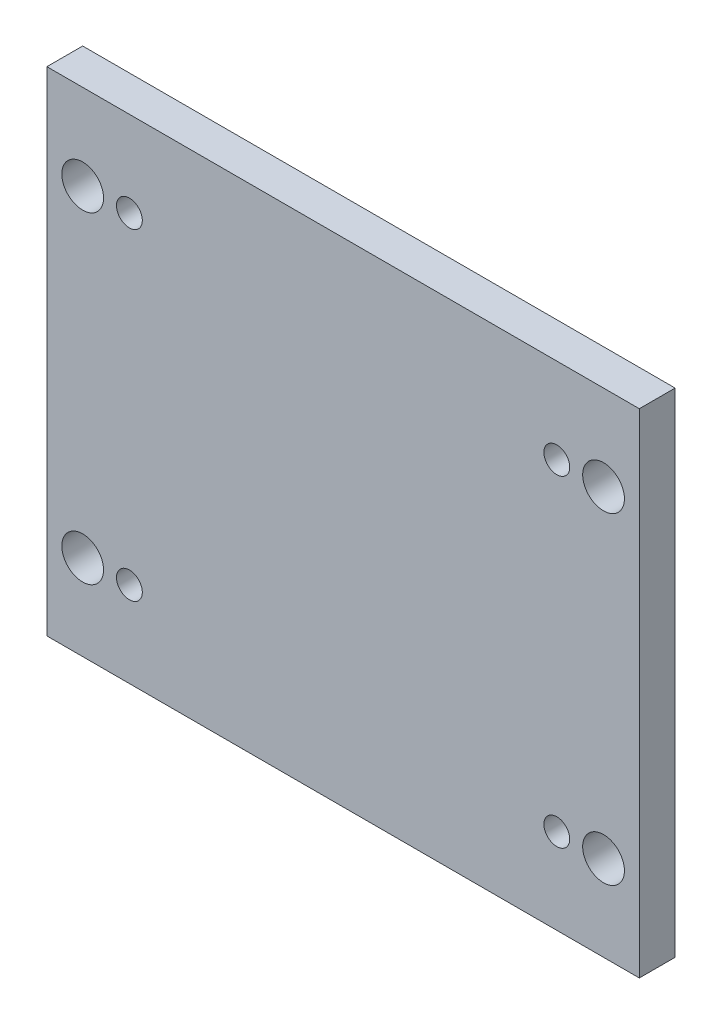
from build123d import *

# Parameters (mm, degrees)
SZKIC1_W                    = 596
SZKIC1_H                    = 496
DODANIE_WYCI_GNI_CIE1_DEPTH = 36
SZKIC2_R                    = 21
WYTNIJ_WYCI_GNI_CIE1_DEPTH  = 36
SZKIC3_R                    = 21
WYTNIJ_WYCI_GNI_CIE2_DEPTH  = 36
SZKIC4_R                    = 21
WYTNIJ_WYCI_GNI_CIE3_DEPTH  = 36
SZKIC5_R                    = 21
WYTNIJ_WYCI_GNI_CIE4_DEPTH  = 36
SZKIC6_W                    = 15
SZKIC6_H                    = 9
SZKIC7_W                    = 15
SZKIC7_H                    = 9
SZKIC8_W                    = 15
SZKIC8_H                    = 9
SZKIC9_W                    = 15
SZKIC9_H                    = 9
SZKIC10_W                   = 21
SZKIC10_H                   = 13
SZKIC11_W                   = 21
SZKIC11_H                   = 13
SZKIC12_W                   = 21
SZKIC12_H                   = 13
SZKIC13_W                   = 21
SZKIC13_H                   = 13


with BuildPart() as part:
    # Szkic1 → Dodanie-wyciągnięcie1 (new body)
    with BuildSketch(Plane.XY):
        Rectangle(SZKIC1_W, SZKIC1_H)
    extrude(amount=DODANIE_WYCI_GNI_CIE1_DEPTH)

    # Szkic2 → Wytnij-wyciągnięcie1 (cut)
    with BuildSketch(Plane.XY.offset(36)):
        with Locations((262, 162)):
            Circle(SZKIC2_R)
    extrude(amount=-WYTNIJ_WYCI_GNI_CIE1_DEPTH, mode=Mode.SUBTRACT)

    # Szkic3 → Wytnij-wyciągnięcie2 (cut)
    with BuildSketch(Plane.XY.offset(36)):
        with Locations((262, -162)):
            Circle(SZKIC3_R)
    extrude(amount=-WYTNIJ_WYCI_GNI_CIE2_DEPTH, mode=Mode.SUBTRACT)

    # Szkic4 → Wytnij-wyciągnięcie3 (cut)
    with BuildSketch(Plane.XY.offset(36)):
        with Locations((-262, -162)):
            Circle(SZKIC4_R)
    extrude(amount=-WYTNIJ_WYCI_GNI_CIE3_DEPTH, mode=Mode.SUBTRACT)

    # Szkic5 → Wytnij-wyciągnięcie4 (cut)
    with BuildSketch(Plane.XY.offset(36)):
        with Locations((-262, 162)):
            Circle(SZKIC5_R)
    extrude(amount=-WYTNIJ_WYCI_GNI_CIE4_DEPTH, mode=Mode.SUBTRACT)

    # Szkic6 → Wycięcie-obrót1 (revolve, cut)
    with BuildSketch(Plane(origin=(215, 0, 0), x_dir=(0, 0, -1), z_dir=(1, 0, 0))):
        with Locations((-7.5, 166.5)):
            Rectangle(SZKIC6_W, SZKIC6_H)
    revolve(axis=Axis((215, 162, 0), (0, 0, 1)), mode=Mode.SUBTRACT)

    # Szkic7 → Wycięcie-obrót2 (revolve, cut)
    with BuildSketch(Plane(origin=(215, 0, 0), x_dir=(0, 0, -1), z_dir=(1, 0, 0))):
        with Locations((-7.5, -166.5)):
            Rectangle(SZKIC7_W, SZKIC7_H)
    revolve(axis=Axis((215, -162, 15), (0, 0, -1)), mode=Mode.SUBTRACT)

    # Szkic8 → Wycięcie-obrót3 (revolve, cut)
    with BuildSketch(Plane(origin=(-215, 0, 0), x_dir=(0, 0, -1), z_dir=(1, 0, 0))):
        with Locations((-7.5, 166.5)):
            Rectangle(SZKIC8_W, SZKIC8_H)
    revolve(axis=Axis((-215, 162, 0), (0, 0, 1)), mode=Mode.SUBTRACT)

    # Szkic9 → Wycięcie-obrót4 (revolve, cut)
    with BuildSketch(Plane(origin=(-215, 0, 0), x_dir=(0, 0, -1), z_dir=(1, 0, 0))):
        with Locations((-7.5, -166.5)):
            Rectangle(SZKIC9_W, SZKIC9_H)
    revolve(axis=Axis((-215, -162, 15), (0, 0, -1)), mode=Mode.SUBTRACT)

    # Szkic10 → Wycięcie-obrót5 (revolve, cut)
    with BuildSketch(Plane(origin=(215, 0, 0), x_dir=(0, 0, -1), z_dir=(1, 0, 0))):
        with Locations((-25.5, 168.5)):
            Rectangle(SZKIC10_W, SZKIC10_H)
    revolve(axis=Axis((215, 162, 15), (0, 0, 1)), mode=Mode.SUBTRACT)

    # Szkic11 → Wycięcie-obrót6 (revolve, cut)
    with BuildSketch(Plane(origin=(215, 0, 0), x_dir=(0, 0, -1), z_dir=(1, 0, 0))):
        with Locations((-25.5, -168.5)):
            Rectangle(SZKIC11_W, SZKIC11_H)
    revolve(axis=Axis((215, -162, 36), (0, 0, -1)), mode=Mode.SUBTRACT)

    # Szkic12 → Wycięcie-obrót7 (revolve, cut)
    with BuildSketch(Plane(origin=(-215, 0, 0), x_dir=(0, 0, -1), z_dir=(1, 0, 0))):
        with Locations((-25.5, -168.5)):
            Rectangle(SZKIC12_W, SZKIC12_H)
    revolve(axis=Axis((-215, -162, 36), (0, 0, -1)), mode=Mode.SUBTRACT)

    # Szkic13 → Wycięcie-obrót8 (revolve, cut)
    with BuildSketch(Plane(origin=(-215, 0, 0), x_dir=(0, 0, -1), z_dir=(1, 0, 0))):
        with Locations((-25.5, 168.5)):
            Rectangle(SZKIC13_W, SZKIC13_H)
    revolve(axis=Axis((-215, 162, 15), (0, 0, 1)), mode=Mode.SUBTRACT)


solid = part.part
